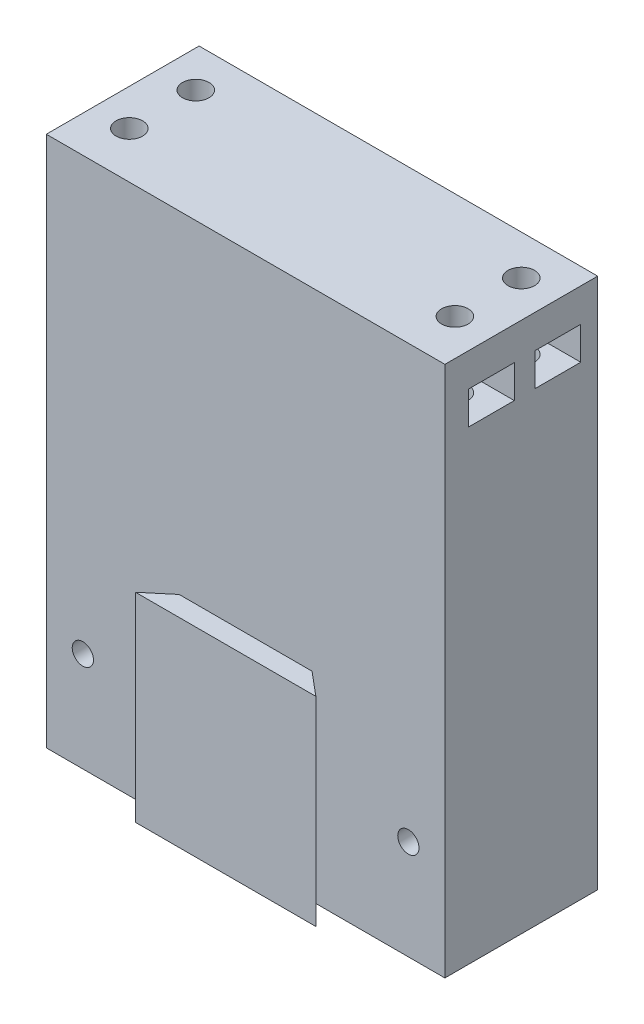
from build123d import *

# Parameters (mm, degrees)
SKETCH_1_W             = 60
SKETCH_1_H             = 80
EXTRUDE_1_DEPTH        = 23
SKETCH_3_R             = 2
CUT_EXTRUDE_2_DEPTH    = 25
EXTRUDE_START          = -50
EXTRUDE_2_DEPTH        = 30
SKETCH_5_R             = 1.6
CUT_EXTRUDE_3_DEPTH    = 57.356011214
CUT_EXTRUDE_START      = -5
SKETCH_7_R             = 2
CUT_EXTRUDE_4_DEPTH    = 4.95
PATTERN_LINEAR_1_COUNT = 2
PATTERN_LINEAR_1_PITCH = 10


with BuildPart() as part:
    # 草图1 → 凸台-拉伸1 (new body)
    with BuildSketch(Plane.XY):
        Rectangle(SKETCH_1_W, SKETCH_1_H)
    extrude(amount=EXTRUDE_1_DEPTH)

    # 草图3 → 切除-拉伸2 (cut)
    with BuildSketch(Plane(origin=(0, 40, 0), x_dir=(1, 0, 0), z_dir=(0, 1, 0))):
        with Locations(Location((24.5, -6, 0), (0, 0, 270))):
            Circle(SKETCH_3_R)
        with Locations(Location((24.5, -16, 0), (0, 0, 270))):
            Circle(SKETCH_3_R)
    cut_extrude_2 = extrude(amount=-CUT_EXTRUDE_2_DEPTH, mode=Mode.SUBTRACT)

    # 镜向1: 切除-拉伸2 across plane
    add(cut_extrude_2.mirror(Plane(origin=(0, 0, 0), x_dir=(0, 0, 1), z_dir=(1, 0, 0))), mode=Mode.SUBTRACT)

    # 草图4 → 凸台-拉伸2 (add)
    with BuildSketch(Plane(origin=(0, 40, 0), x_dir=(1, 0, 0), z_dir=(0, 1, 0)).offset(EXTRUDE_START)):
        Polygon((13.575260778, -26), (10, -23), (0, -23), (0, -26), align=None)
        Polygon((0, -26), (0, -23), (-10, -23), (-13.575260778, -26), align=None)
    extrude(amount=-EXTRUDE_2_DEPTH)

    # 草图5 → 切除-拉伸3 (cut, through all)
    with BuildSketch(Plane(origin=(0, 0, 0), x_dir=(-1, 0, 0), z_dir=(0, 0, -1))):
        with Locations((-24.5, -25)):
            Circle(SKETCH_5_R)
        with Locations((24.5, -25)):
            Circle(SKETCH_5_R)
    extrude(amount=-CUT_EXTRUDE_3_DEPTH, mode=Mode.SUBTRACT)

    # 草图7 → 切除-拉伸4 (cut)
    # profile 1 of 3: a face of its own
    with BuildSketch(Plane(origin=(0, 40, 0), x_dir=(1, 0, 0), z_dir=(0, 1, 0)).offset(CUT_EXTRUDE_START)):
        Polygon((-26.491858429, -9.45), (-22.508141571, -9.45), (-20.516283143, -6), (-22.508141571, -2.55), (-26.491858429, -2.55), (-30, -2.55), (-30, -9.45), align=None)
        with Locations(Location((-24.5, -6, 0), (0, 0, 270))):
            Circle(SKETCH_7_R, mode=Mode.SUBTRACT)
    # profile 2 of 3: a face of its own
    with BuildSketch(Plane(origin=(0, 40, 0), x_dir=(1, 0, 0), z_dir=(0, 1, 0)).offset(CUT_EXTRUDE_START)):
        Polygon((26.491858429, -9.45), (28.483716857, -6), (26.491858429, -2.55), (22.508141571, -2.55), (20.516283143, -6), (22.508141571, -9.45), align=None)
        with Locations(Location((24.5, -6, 0), (0, 0, 270))):
            Circle(SKETCH_7_R, mode=Mode.SUBTRACT)
    # profile 3 of 3: a face of its own
    with BuildSketch(Plane(origin=(0, 40, 0), x_dir=(1, 0, 0), z_dir=(0, 1, 0)).offset(CUT_EXTRUDE_START)):
        Polygon((26.491858429, -9.45), (30, -9.45), (30, -2.55), (26.491858429, -2.55), (28.483716857, -6), align=None)
    cut_extrude_4 = extrude(amount=-CUT_EXTRUDE_4_DEPTH, mode=Mode.SUBTRACT)

    # 阵列(线性)1: 切除-拉伸4 ×2
    with Locations(*[(0, 0, i * PATTERN_LINEAR_1_PITCH) for i in range(1, PATTERN_LINEAR_1_COUNT)]):
        add(cut_extrude_4, mode=Mode.SUBTRACT)


solid = part.part
